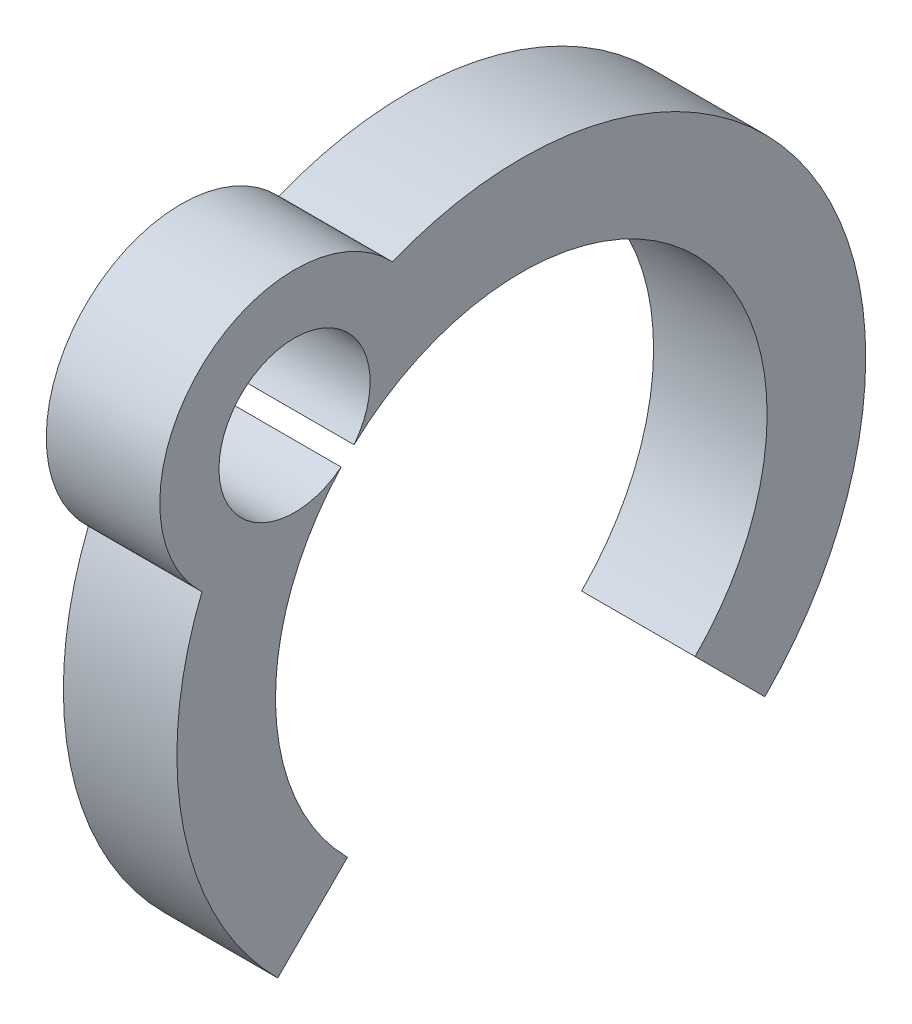
from build123d import *

# Parameters (mm, degrees)
BOSS_EXTRUDE1_DEPTH = 1.7272


with BuildPart() as part:
    # Sketch1 → Boss-Extrude1 (new body)
    with BuildSketch(Plane(origin=(0, 0, 0), x_dir=(0, 0, -1), z_dir=(1, 0, 0))):
        with BuildLine():
            Line((-3.705239533, -3.705239533), (-2.644579362, -2.644579362))
            ThreePointArc((-2.644579362, -2.644579362), (-3.739357011, -0.069348011), (-2.740816906, 2.544704833))
            ThreePointArc((-2.740816906, 2.544704833), (-4.263172798, 4.263172798), (-2.544704833, 2.740816906))
            ThreePointArc((-2.544704833, 2.740816906), (2.693161148, 2.595088251), (2.644579362, -2.644579362))
            Line((2.644579362, -2.644579362), (3.705239533, -3.705239533))
            ThreePointArc((3.705239533, -3.705239533), (4.370099572, 2.891337015), (-1.961131073, 4.859173275))
            ThreePointArc((-1.961131073, 4.859173275), (-4.899568901, 4.899568901), (-4.859173275, 1.961131073))
            ThreePointArc((-4.859173275, 1.961131073), (-5.134611051, -1.045643032), (-3.705239533, -3.705239533))
        make_face()
    extrude(amount=BOSS_EXTRUDE1_DEPTH)


solid = part.part
